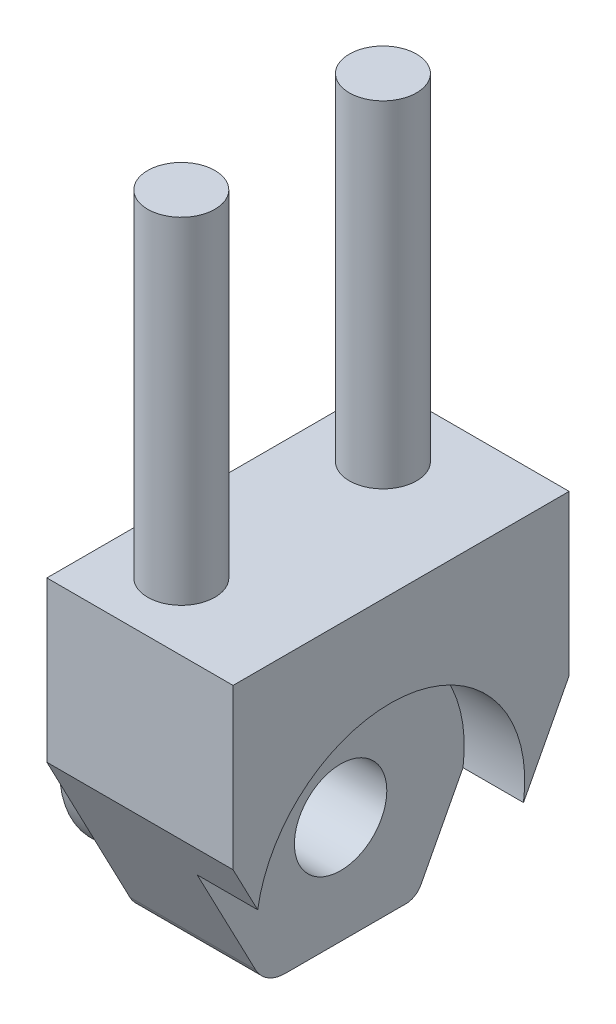
from build123d import *

# Parameters (mm, degrees)
ESQUISSE1_W             = 22.16
ESQUISSE1_H             = 40
BOSS_EXTRU_1_DEPTH      = 40
CHANFREIN1_SIZE         = 11
CHANFREIN1_SIZE2        = 21
CHANFREIN2_SIZE         = 11
CHANFREIN2_SIZE2        = 21
CONG_1_R                = 4
ESQUISSE2_R             = 4
BOSS_EXTRU_2_DEPTH      = 40
ESQUISSE2_3_R           = 4
BOSS_EXTRU_3_DEPTH      = 40
ESQUISSE3_R             = 12.5
BOSS_EXTRU_4_DEPTH      = 6
ESQUISSE4_R             = 16
ENL_V_MAT_EXTRU_1_DEPTH = 7.2
ESQUISSE6_W             = 12.088624029
ESQUISSE6_H             = 7.650078289
ENL_V_MAT_EXTRU_2_DEPTH = 86.171439898
CONG_2_R                = 2
ESQUISSE8_R             = 5.5
ENL_V_MAT_EXTRU_5_DEPTH = 15


with BuildPart() as part:
    # Esquisse1 → Boss.-Extru.1 (new body)
    with BuildSketch(Plane(origin=(0, 0, 0), x_dir=(1, 0, 0), z_dir=(0, 1, 0))):
        with Locations((26.894106866, -0.367930046)):
            Rectangle(ESQUISSE1_W, ESQUISSE1_H)
    extrude(amount=BOSS_EXTRU_1_DEPTH)

    # Chanfrein1
    chanfrein1_edges = [part.edges().sort_by_distance(p)[0] for p in [
        (26.894106866, 0, 20.367930046),
    ]]
    chanfrein1_side = [part.faces().sort_by_distance(p)[0] for p in [
        (26.894106866, 0, 0.367930046),
    ]]
    chamfer(chanfrein1_edges, length=CHANFREIN1_SIZE, length2=CHANFREIN1_SIZE2, reference=chanfrein1_side[0])

    # Chanfrein2
    chanfrein2_edges = [part.edges().sort_by_distance(p)[0] for p in [
        (26.894106866, 0, -19.632069954),
    ]]
    chanfrein2_side = [part.faces().sort_by_distance(p)[0] for p in [
        (26.894106866, 0, -5.132069954),
    ]]
    chamfer(chanfrein2_edges, length=CHANFREIN2_SIZE, length2=CHANFREIN2_SIZE2, reference=chanfrein2_side[0])

    # Congé1
    cong_1_edges = [part.edges().sort_by_distance(p)[0] for p in [
        (26.894106866, 0, 9.367930046),
    ]]
    fillet(cong_1_edges, radius=CONG_1_R)

    # Esquisse2 → Boss.-Extru.2 (add)
    with BuildSketch(Plane(origin=(0, 40, 0), x_dir=(1, 0, 0), z_dir=(0, 1, 0))):
        with Locations((23.814106866, 11.632069954)):
            Circle(ESQUISSE2_R)
    extrude(amount=BOSS_EXTRU_2_DEPTH)

    # Esquisse2<3> → Boss.-Extru.3 (add)
    with BuildSketch(Plane(origin=(0, 40, 0), x_dir=(1, 0, 0), z_dir=(0, 1, 0))):
        with Locations((23.814106866, -12.367930046)):
            Circle(ESQUISSE2_3_R)
        with Locations((23.814106866, 11.632069954)):
            Circle(ESQUISSE2_3_R)
    extrude(amount=BOSS_EXTRU_3_DEPTH)

    # Esquisse3 → Boss.-Extru.4 (add)
    with BuildSketch(Plane.ZY.offset(-15.814106866)):
        with Locations((0.367930046, 13.5)):
            Circle(ESQUISSE3_R)
    extrude(amount=BOSS_EXTRU_4_DEPTH)

    # Esquisse4 → Enlèv. mat.-Extru.1 (cut)
    with BuildSketch(Plane(origin=(37.974106866, 0, 0), x_dir=(0, 0, -1), z_dir=(1, 0, 0))):
        with Locations((-1.650800507, 12.8)):
            Circle(ESQUISSE4_R)
    extrude(amount=-ENL_V_MAT_EXTRU_1_DEPTH, mode=Mode.SUBTRACT)

    # Esquisse6 → Enlèv. mat.-Extru.2 (cut, through all)
    with BuildSketch(Plane(origin=(30.774106866, 0, 0), x_dir=(0, 0, -1), z_dir=(1, 0, 0))):
        with Locations((6.871590707, 0.920255373)):
            Rectangle(ESQUISSE6_W, ESQUISSE6_H)
    extrude(amount=ENL_V_MAT_EXTRU_2_DEPTH, mode=Mode.SUBTRACT)

    # Congé2
    cong_2_edges = [part.edges().sort_by_distance(p)[0] for p in [
        (23.294106866, 0, -8.632069954),
    ]]
    fillet(cong_2_edges, radius=CONG_2_R)

    # Esquisse8 → Enlèv. mat.-Extru.5 (cut)
    with BuildSketch(Plane(origin=(37.974106866, 0, -37.974106866), x_dir=(0, 0, 1), z_dir=(-1, 0, 0))):
        with Locations((38.342036913, 12.8)):
            Circle(ESQUISSE8_R)
    extrude(amount=ENL_V_MAT_EXTRU_5_DEPTH, mode=Mode.SUBTRACT)


solid = part.part
